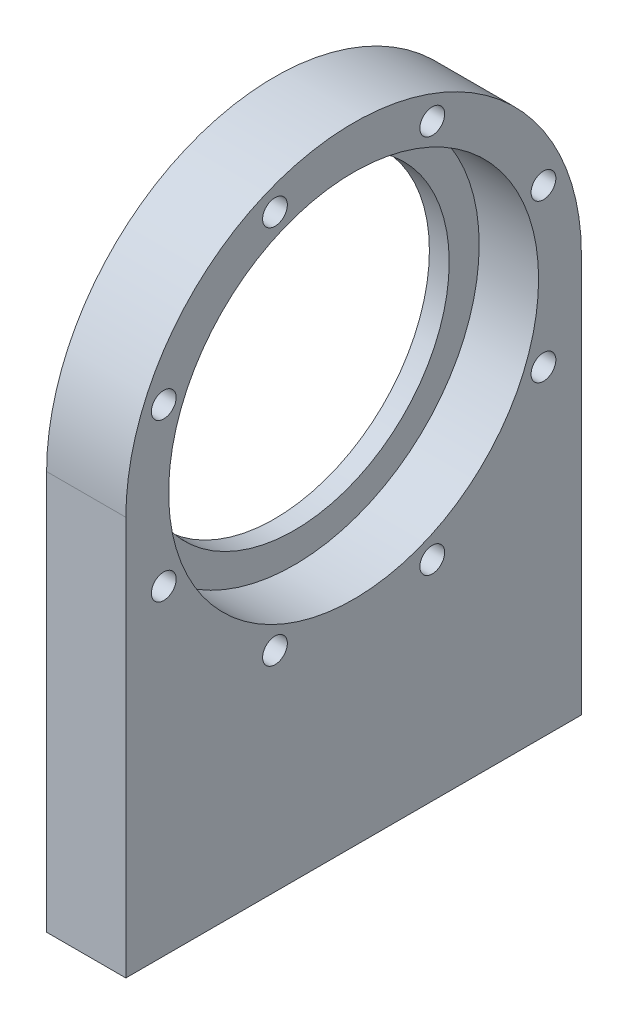
from build123d import *

# Parameters (mm, degrees)
SKETCH_1_R          = 18.68
SKETCH_1_R_2        = 15.652173913
EXTRUDE_2_DEPTH     = 2
SKETCH_1_4_R        = 23
SKETCH_1_4_R_2      = 1.25
SKETCH_1_4_R_3      = 18.68
EXTRUDE_3_DEPTH     = 8
EXTRUDE_4_DEPTH     = 8
SKETCH_3_R          = 1.8
CUT_EXTRUDE_1_DEPTH = 5


with BuildPart() as part:
    # 草图1 → 凸台-拉伸2 (new body)
    with BuildSketch(Plane(origin=(0, 0, 0), x_dir=(0, 0, -1), z_dir=(1, 0, 0))):
        Circle(SKETCH_1_R)
        Circle(SKETCH_1_R_2, mode=Mode.SUBTRACT)
    extrude(amount=EXTRUDE_2_DEPTH)

    # 草图1<4> → 凸台-拉伸3 (add)
    with BuildSketch(Plane(origin=(0, 0, 0), x_dir=(0, 0, -1), z_dir=(1, 0, 0))):
        Circle(SKETCH_1_4_R)
        with Locations((-7.940681222, -19.1705003)):
            Circle(SKETCH_1_4_R_2, mode=Mode.SUBTRACT)
        with Locations((-19.1705003, -7.940681222)):
            Circle(SKETCH_1_4_R_2, mode=Mode.SUBTRACT)
        with Locations((7.940681222, -19.1705003)):
            Circle(SKETCH_1_4_R_2, mode=Mode.SUBTRACT)
        with Locations((19.1705003, -7.940681222)):
            Circle(SKETCH_1_4_R_2, mode=Mode.SUBTRACT)
        with Locations((-19.1705003, 7.940681222)):
            Circle(SKETCH_1_4_R_2, mode=Mode.SUBTRACT)
        with Locations((-7.940681222, 19.1705003)):
            Circle(SKETCH_1_4_R_2, mode=Mode.SUBTRACT)
        Circle(SKETCH_1_4_R_3, mode=Mode.SUBTRACT)
        with Locations((19.1705003, 7.940681222)):
            Circle(SKETCH_1_4_R_2, mode=Mode.SUBTRACT)
        with Locations((7.940681222, 19.1705003)):
            Circle(SKETCH_1_4_R_2, mode=Mode.SUBTRACT)
    extrude(amount=EXTRUDE_3_DEPTH)

    # 草图2 → 凸台-拉伸4 (add)
    with BuildSketch(Plane.ZY):
        with BuildLine():
            Line((-23, -40.29), (-23, 0))
            ThreePointArc((-23, 0), (0, -23), (23, 0))
            Line((23, 0), (23, -40.29))
            Line((23, -40.29), (-23, -40.29))
        make_face()
    extrude(amount=-EXTRUDE_4_DEPTH)

    # 草图3 → 切除-拉伸1 (cut)
    with BuildSketch(Plane.XZ.offset(40.29)):
        with Locations((4, 19)):
            Circle(SKETCH_3_R)
    cut_extrude_1 = extrude(amount=-CUT_EXTRUDE_1_DEPTH, mode=Mode.SUBTRACT)

    # 镜向1: 切除-拉伸1 across plane
    add(cut_extrude_1.mirror(Plane(origin=(0, 0, 0), x_dir=(1, 0, 0), z_dir=(0, 0, -1))), mode=Mode.SUBTRACT)


solid = part.part
